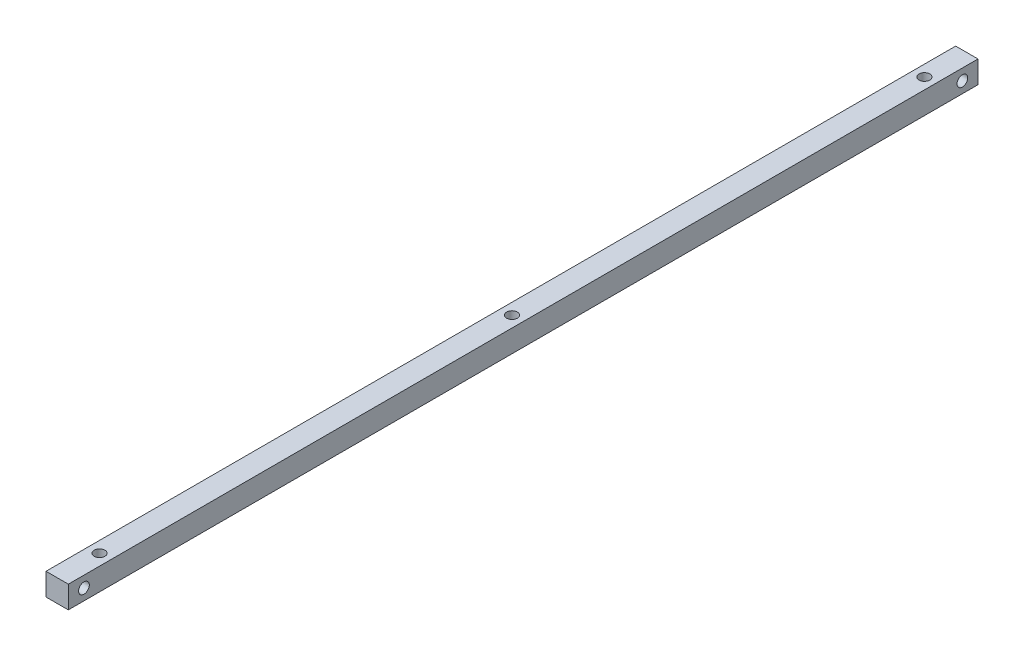
from build123d import *

# Parameters (mm, degrees)
CROQUIS1_W              = 254.7
CROQUIS1_H              = 6.25
SALIENTE_EXTRUIR1_DEPTH = 3.125
CROQUIS2_R              = 1.5
CORTAR_EXTRUIR1_DEPTH   = 20
CROQUIS3_R              = 1.5
CORTAR_EXTRUIR2_DEPTH   = 30


with BuildPart() as part:
    # Croquis1 → Saliente-Extruir1 (new, symmetric)
    with BuildSketch(Plane(origin=(0, 0, 0), x_dir=(0, 0, -1), z_dir=(1, 0, 0))):
        Rectangle(CROQUIS1_W, CROQUIS1_H)
    extrude(amount=SALIENTE_EXTRUIR1_DEPTH, both=True)

    # Croquis2 → Cortar-Extruir1 (cut, symmetric)
    with BuildSketch(Plane(origin=(3.125, 0, 0), x_dir=(0, 0, -1), z_dir=(1, 0, 0))):
        with Locations(Location((-122.975, 0, 0), (0, 0, 180))):
            Circle(CROQUIS2_R)
        with Locations(Location((122.975, 0, 0), (0, 0, 180))):
            Circle(CROQUIS2_R)
    extrude(amount=CORTAR_EXTRUIR1_DEPTH, both=True, mode=Mode.SUBTRACT)

    # Croquis3 → Cortar-Extruir2 (cut, symmetric)
    with BuildSketch(Plane.XZ.offset(3.125)):
        with Locations(Location((0, 115.475, 0), (0, 0, 270))):
            Circle(CROQUIS3_R)
        with Locations(Location((0, -115.475, 0), (0, 0, 270))):
            Circle(CROQUIS3_R)
        with Locations(Location((0, 0, 0), (0, 0, 270))):
            Circle(CROQUIS3_R)
    extrude(amount=CORTAR_EXTRUIR2_DEPTH, both=True, mode=Mode.SUBTRACT)


solid = part.part
